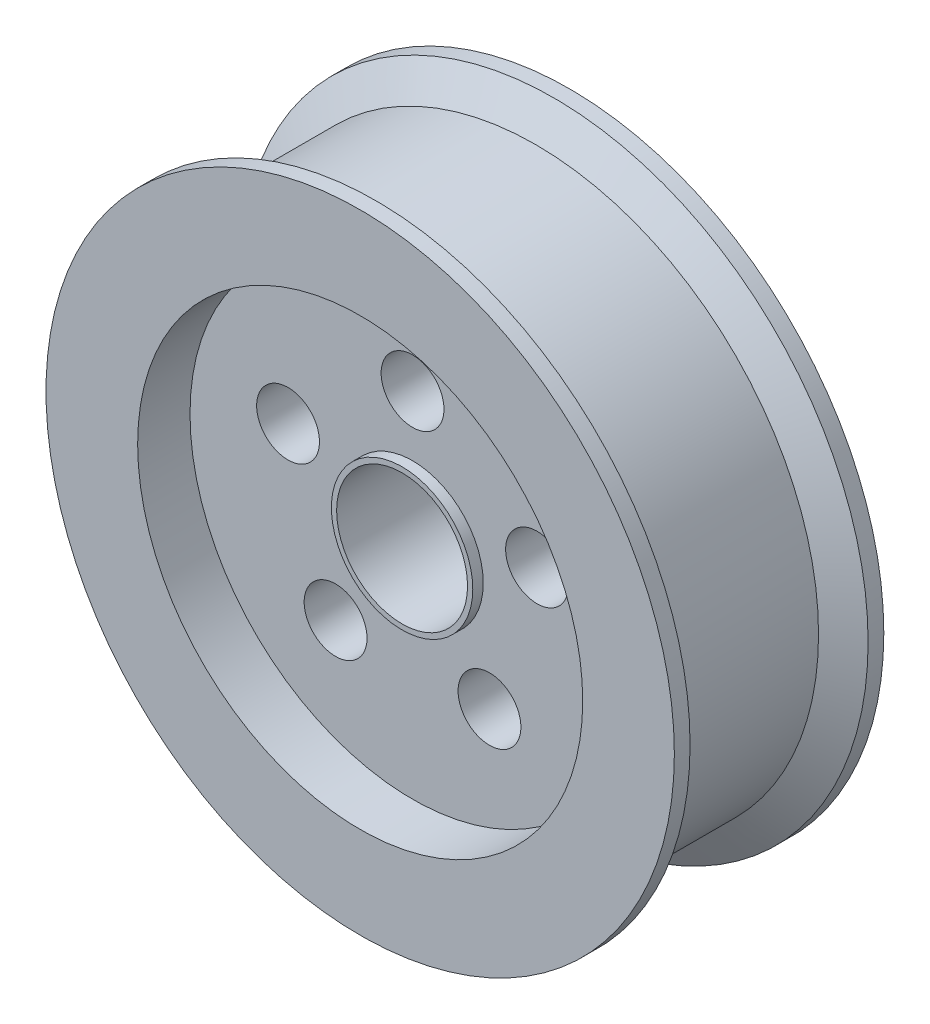
from build123d import *

# Parameters (mm, degrees)
SKETCH2_R                = 60
SKETCH2_R_2              = 12.5
BOSS_EXTRUDE1_DEPTH      = 20
SKETCH3_R                = 42.5
CUT_EXTRUDE1_DEPTH       = 10
SKETCH4_R                = 6
CUT_EXTRUDE2_DEPTH       = 91
CIRPATTERN2_COUNT        = 5
BOSS_EXTRUDE3_DEPTH      = 2
BOSS_EXTRUDE3_DEPTH_BACK = 7
SKETCH6_R                = 13.5
SKETCH6_R_2              = 12.5


with BuildPart() as part:
    # Sketch2 → Boss-Extrude1 (new, symmetric)
    with BuildSketch(Plane.XY):
        Circle(SKETCH2_R)
        Circle(SKETCH2_R_2, mode=Mode.SUBTRACT)
    extrude(amount=BOSS_EXTRUDE1_DEPTH, both=True)

    # Sketch3 → Cut-Extrude1 (cut)
    with BuildSketch(Plane.XY.offset(20)):
        Circle(SKETCH3_R)
    cut_extrude1 = extrude(amount=-CUT_EXTRUDE1_DEPTH, mode=Mode.SUBTRACT)

    # Mirror2: Cut-Extrude1 across plane
    add(cut_extrude1.mirror(Plane.XY), mode=Mode.SUBTRACT)

    # Sketch4 → Cut-Extrude2 (cut, symmetric)
    with BuildSketch(Plane.XY.offset(10)):
        with Locations((0, 25)):
            Circle(SKETCH4_R)
    cut_extrude2 = extrude(amount=CUT_EXTRUDE2_DEPTH, both=True, mode=Mode.SUBTRACT)

    # CirPattern2: Cut-Extrude2 ×5 about axis
    cirpattern2_axis = Axis((0, 0, 0), (0, 0, 1))
    for i in range(1, CIRPATTERN2_COUNT):
        add(cut_extrude2.rotate(cirpattern2_axis, i * 360 / CIRPATTERN2_COUNT), mode=Mode.SUBTRACT)

    # Sketch5 → Cut-Revolve1 (revolve, cut)
    with BuildSketch(Plane(origin=(0, 0, 0), x_dir=(1, 0, 0), z_dir=(0, 1, 0))):
        Polygon((54, 13.535898385), (60, 17), (60, -17), (54, -13.535898385), align=None)
    revolve(axis=Axis((0, 0, 0), (0, 0, -1)), mode=Mode.SUBTRACT)

    # Sketch6 → Boss-Extrude3 (add, two sides: drawn at the far end of the back side and taken through both)
    with BuildSketch(Plane.XY.offset(10).offset(-BOSS_EXTRUDE3_DEPTH_BACK)):
        Circle(SKETCH6_R)
        with Locations(Location((0, 0, 0), (0, 0, 180))):
            Circle(SKETCH6_R_2, mode=Mode.SUBTRACT)
    extrude(amount=BOSS_EXTRUDE3_DEPTH + BOSS_EXTRUDE3_DEPTH_BACK)


solid = part.part
